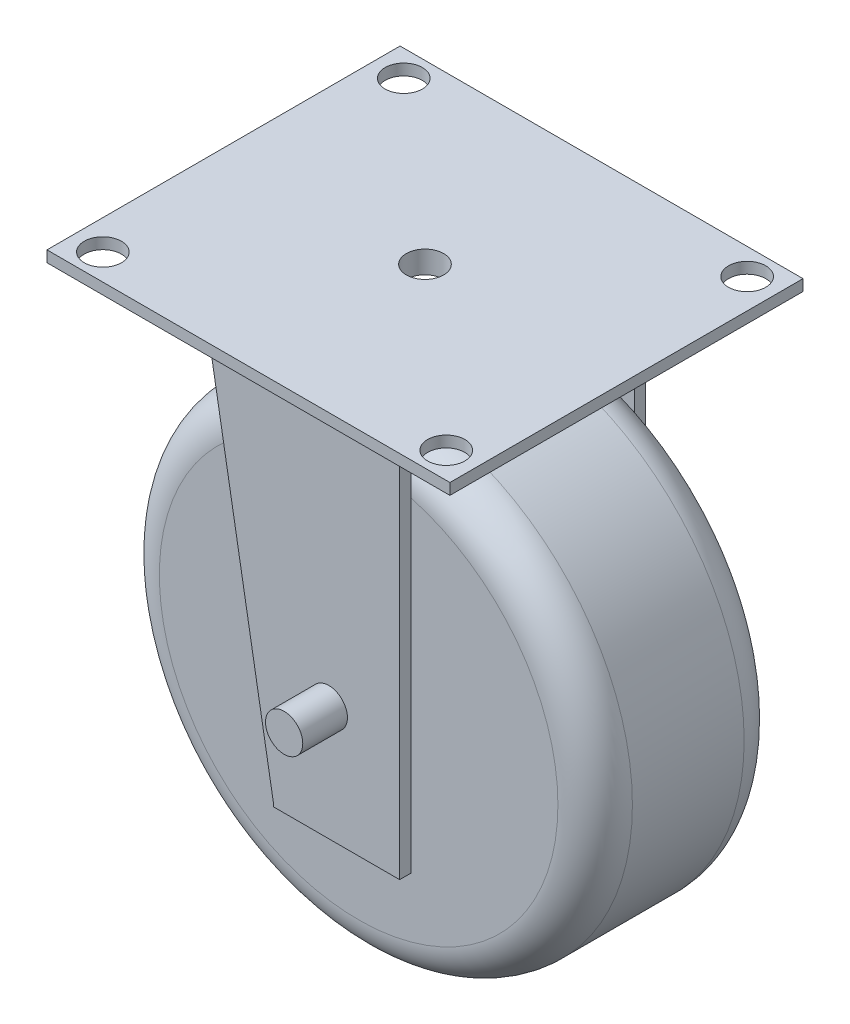
from build123d import *

# Parameters (mm, degrees)
SKETCH_1_R             = 63.5
EXTRUDE_1_DEPTH        = 50
FILLET_1_R             = 10
SKETCH_2_R             = 5
EXTRUDE_2_DEPTH        = 20
EXTRUDE_START          = 20
SKETCH_3_R             = 5
EXTRUDE_3_DEPTH        = 20
EXTRUDE_START_2        = 3
SKETCH_4_R             = 5
EXTRUDE_4_DEPTH        = 3
PATTERN_LINEAR_1_COUNT = 2
PATTERN_LINEAR_1_PITCH = 63
SKETCH_5_W             = 52.384505053
SKETCH_5_H             = 66
EXTRUDE_5_DEPTH        = 3
SKETCH_6_R             = 5
CUT_EXTRUDE_1_DEPTH    = 3
SKETCH_7_W             = 108.179639097
SKETCH_7_H             = 94.795773282
SKETCH_7_R             = 5
EXTRUDE_6_DEPTH        = 3


with BuildPart() as part:
    # 草图1 → 凸台-拉伸1 (new body)
    with BuildSketch(Plane.XY):
        Circle(SKETCH_1_R)
    extrude(amount=EXTRUDE_1_DEPTH)

    # 圆角1
    fillet_1_edges = [part.edges().sort_by_distance(p)[0] for p in [
        (-63.5, 0, 0),
        (-63.5, 0, 50),
    ]]
    fillet(fillet_1_edges, radius=FILLET_1_R)

    # 草图2 → 凸台-拉伸2 (add)
    with BuildSketch(Plane(origin=(0, 0, 0), x_dir=(-1, 0, 0), z_dir=(0, 0, -1))):
        with Locations(Location((0, 0, 0), (0, 0, 180))):
            Circle(SKETCH_2_R)
    extrude(amount=EXTRUDE_2_DEPTH)

    # 草图3 → 凸台-拉伸3 (add)
    with BuildSketch(Plane.XY.offset(50).offset(EXTRUDE_START)):
        Circle(SKETCH_3_R)
    extrude(amount=-EXTRUDE_3_DEPTH)

    # 草图4 → 凸台-拉伸4 (add)
    with BuildSketch(Plane.XY.offset(55).offset(EXTRUDE_START_2)):
        Polygon((-14.847710206, -30.641134437), (19.008851919, -30.641134437), (19.008851919, 76.850518215), (-33.375653134, 76.850518215), (-14.847710206, -29.89657058), align=None)
        Circle(SKETCH_4_R, mode=Mode.SUBTRACT)
    extrude_4 = extrude(amount=-EXTRUDE_4_DEPTH)

    # 阵列(线性)1: 凸台-拉伸4 ×2
    with Locations(*[(0, 0, -i * PATTERN_LINEAR_1_PITCH) for i in range(1, PATTERN_LINEAR_1_COUNT)]):
        add(extrude_4)

    # 草图5 → 凸台-拉伸5 (add)
    with BuildSketch(Plane(origin=(0, 76.850518215, 0), x_dir=(1, 0, 0), z_dir=(0, 1, 0))):
        with Locations((-7.183400608, -25)):
            Rectangle(SKETCH_5_W, SKETCH_5_H)
    extrude(amount=EXTRUDE_5_DEPTH)

    # 草图6 → 切除-拉伸1 (cut)
    with BuildSketch(Plane(origin=(0, 79.850518215, 0), x_dir=(1, 0, 0), z_dir=(0, 1, 0))):
        with Locations(Location((-7.183400607, -25, 0), (0, 0, 270))):
            Circle(SKETCH_6_R)
    extrude(amount=-CUT_EXTRUDE_1_DEPTH, mode=Mode.SUBTRACT)

    # 草图7 → 凸台-拉伸6 (add)
    with BuildSketch(Plane(origin=(0, 79.850518215, 0), x_dir=(1, 0, 0), z_dir=(0, 1, 0)).offset(EXTRUDE_START_2)):
        with Locations((-7.183400607, -25)):
            Rectangle(SKETCH_7_W, SKETCH_7_H)
        with Locations(Location((-53.277526454, 15.391411359, 0), (0, 0, 270))):
            Circle(SKETCH_7_R, mode=Mode.SUBTRACT)
        with Locations(Location((-53.277526454, -65.391411359, 0), (0, 0, 270))):
            Circle(SKETCH_7_R, mode=Mode.SUBTRACT)
        with Locations(Location((38.910725239, -65.391411359, 0), (0, 0, 270))):
            Circle(SKETCH_7_R, mode=Mode.SUBTRACT)
        with Locations(Location((38.910725239, 15.391411359, 0), (0, 0, 270))):
            Circle(SKETCH_7_R, mode=Mode.SUBTRACT)
        with Locations(Location((-7.183400607, -25, 0), (0, 0, 270))):
            Circle(SKETCH_7_R, mode=Mode.SUBTRACT)
    extrude(amount=-EXTRUDE_6_DEPTH)


solid = part.part
